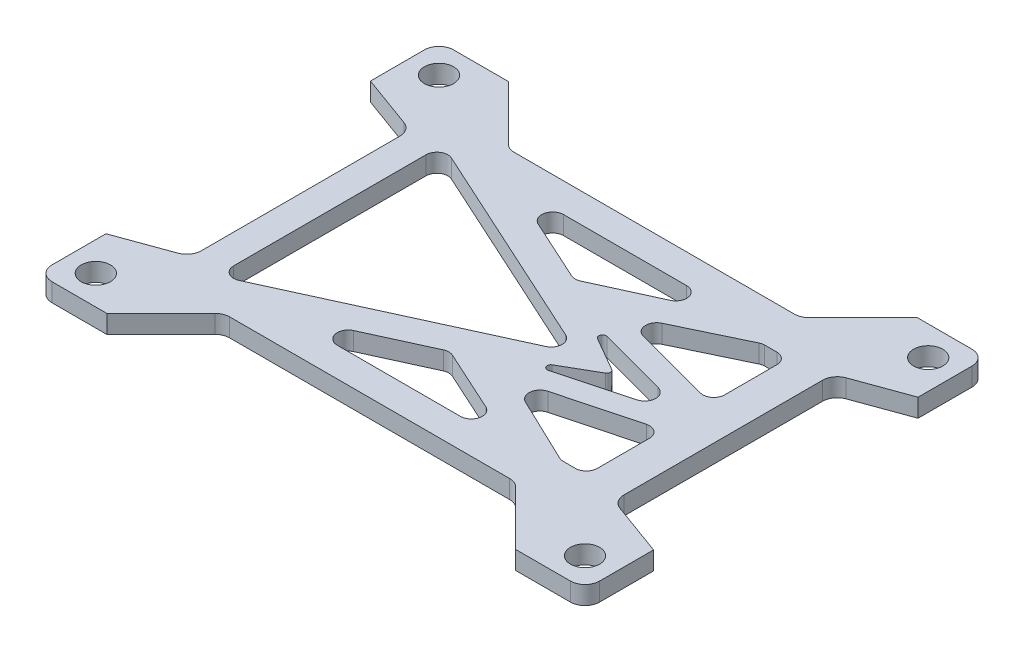
from build123d import *

# Parameters (mm, degrees)
EXTRUDE_1_DEPTH     = 2.5
FILLET_2_R          = 1.5
FILLET_3_R          = 0.5
SKETCH_3_R          = 2
CUT_EXTRUDE_1_DEPTH = 47.569840025
FILLET_4_R          = 2


with BuildPart() as part:
    # 草图2 → 凸台-拉伸1 (new body)
    with BuildSketch(Plane(origin=(0, 0, 0), x_dir=(1, 0, 0), z_dir=(0, 1, 0))):
        Polygon((-37.5, 27.5), (-28, 27.5), (-20, 19.5), (20, 19.5), (28, 27.5), (37.5, 27.5), (37.5, 18.111945503), (28.95, 15), (28.95, -15), (37.5, -18.111945503), (37.5, -27.5), (28, -27.5), (20, -19.5), (-20, -19.5), (-28, -27.5), (-37.5, -27.5), (-37.5, -18.111945503), (-28.95, -15), (-28.95, 15), (-37.5, 18.111945503), align=None)
        Polygon((15.323396198, 15.5), (0, 8.5), (-15.323396198, 15.5), align=None, mode=Mode.SUBTRACT)
        Polygon((-24.95, 15.5), (-24.95, -15.5), (8.980377297, 0), align=None, mode=Mode.SUBTRACT)
        Polygon((-15.323396198, -15.5), (15.323396198, -15.5), (0, -8.5), align=None, mode=Mode.SUBTRACT)
        Polygon((5.320123259, 5), (13.980377297, 0), (5.320123259, -5), (23.980377297, 0), align=None, mode=Mode.SUBTRACT)
        Polygon((7.499709521, 7.581961581), (20.478475988, 13.793792116), (23.980377297, 13.793792116), (23.980377297, 3.206634177), align=None, mode=Mode.SUBTRACT)
        Polygon((23.980377297, -13.793792116), (23.980377297, -3.206634177), (7.499709521, -7.581961581), (20.478475988, -13.793792116), align=None, mode=Mode.SUBTRACT)
    extrude(amount=EXTRUDE_1_DEPTH)

    # 圆角2
    fillet_2_edges = [part.edges().sort_by_distance(p)[0] for p in [
        (20.478475988, 1.25, 13.793792116),
        (23.980377297, 1.25, 13.793792116),
        (23.980377297, 1.25, 3.206634177),
        (7.499709521, 1.25, 7.581961581),
        (0, 1.25, 8.5),
        (-15.323396198, 1.25, 15.5),
        (15.323396198, 1.25, 15.5),
        (8.980377297, 1.25, 0),
        (-24.95, 1.25, -15.5),
        (-24.95, 1.25, 15.5),
        (-15.323396198, 1.25, -15.5),
        (0, 1.25, -8.5),
        (15.323396198, 1.25, -15.5),
        (23.980377297, 1.25, 0),
        (7.499709521, 1.25, -7.581961581),
        (23.980377297, 1.25, -3.206634177),
        (23.980377297, 1.25, -13.793792116),
        (20.478475988, 1.25, -13.793792116),
    ]]
    fillet(fillet_2_edges, radius=FILLET_2_R)

    # 圆角3
    fillet_3_edges = [part.edges().sort_by_distance(p)[0] for p in [
        (5.320123259, 1.25, -5),
        (13.980377297, 1.25, 0),
        (5.320123259, 1.25, 5),
    ]]
    fillet(fillet_3_edges, radius=FILLET_3_R)

    # 草图3 → 切除-拉伸1 (cut, through all)
    with BuildSketch(Plane(origin=(0, 2.5, 0), x_dir=(1, 0, 0), z_dir=(0, 1, 0))):
        with Locations(Location((-33.5, -23.5, 0), (0, 0, 270))):
            Circle(SKETCH_3_R)
        with Locations(Location((33.5, -23.5, 0), (0, 0, 270))):
            Circle(SKETCH_3_R)
        with Locations(Location((33.5, 23.5, 0), (0, 0, 90))):
            Circle(SKETCH_3_R)
        with Locations(Location((-33.5, 23.5, 0), (0, 0, 90))):
            Circle(SKETCH_3_R)
    extrude(amount=-CUT_EXTRUDE_1_DEPTH, mode=Mode.SUBTRACT)

    # 圆角4
    fillet_4_edges = [part.edges().sort_by_distance(p)[0] for p in [
        (20, 1.25, 19.5),
        (-20, 1.25, 19.5),
        (-37.5, 1.25, 27.5),
        (-28.95, 1.25, 15),
        (-28.95, 1.25, -15),
        (-37.5, 1.25, -27.5),
        (-20, 1.25, -19.5),
        (20, 1.25, -19.5),
        (37.5, 1.25, -27.5),
        (28.95, 1.25, -15),
        (28.95, 1.25, 15),
        (37.5, 1.25, 27.5),
    ]]
    fillet(fillet_4_edges, radius=FILLET_4_R)


solid = part.part
